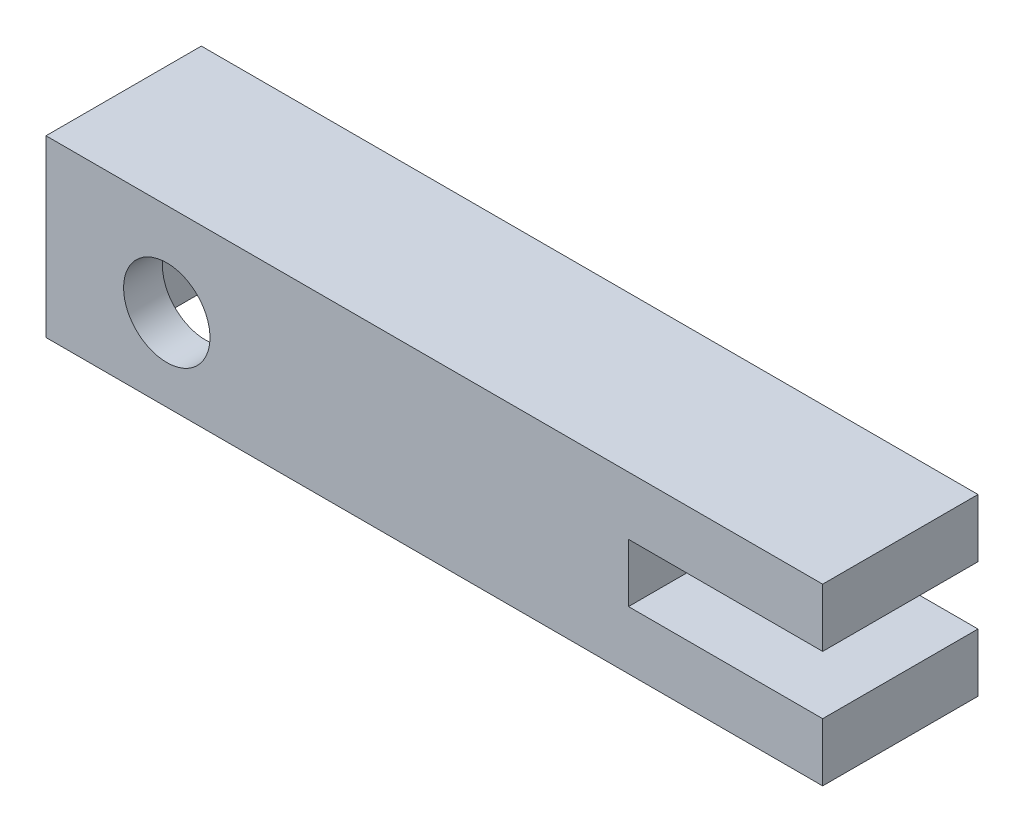
from build123d import *

# Parameters (mm, degrees)
CROQUIS1_W              = 350
CROQUIS1_H              = 40
SALIENTE_EXTRUIR1_DEPTH = 45
CROQUIS2_W              = 42.2
CROQUIS2_H              = 42.2
CORTAR_EXTRUIR1_DEPTH   = 30
CROQUIS3_R              = 11.125
CORTAR_EXTRUIR2_DEPTH   = 30
CROQUIS4_R              = 11.125
CORTAR_EXTRUIR3_DEPTH   = 186.067555233


with BuildPart() as part:
    # Croquis1 → Saliente-Extruir1 (new body)
    with BuildSketch(Plane(origin=(0, 0, 0), x_dir=(1, 0, 0), z_dir=(0, 1, 0))):
        Rectangle(CROQUIS1_W, CROQUIS1_H)
    extrude(amount=SALIENTE_EXTRUIR1_DEPTH)

    # Croquis2 → Cortar-Extruir1 (cut)
    with BuildSketch(Plane(origin=(0, 0, -20), x_dir=(-1, 0, 0), z_dir=(0, 0, -1))):
        with Locations((-143.9, 21.1)):
            Rectangle(CROQUIS2_W, CROQUIS2_H)
    cortar_extruir1 = extrude(amount=-CORTAR_EXTRUIR1_DEPTH, mode=Mode.SUBTRACT)

    # Croquis3 → Cortar-Extruir2 (cut)
    with BuildSketch(Plane(origin=(0, 0, 10), x_dir=(-1, 0, 0), z_dir=(0, 0, -1))):
        with Locations((-143.9, 21.1)):
            Circle(CROQUIS3_R)
    cortar_extruir2 = extrude(amount=-CORTAR_EXTRUIR2_DEPTH, mode=Mode.SUBTRACT)

    # Simetría1: Cortar-Extruir1, Cortar-Extruir2 across plane
    add(cortar_extruir1.mirror(Plane(origin=(0, 0, 0), x_dir=(0, 0, 1), z_dir=(1, 0, 0))), mode=Mode.SUBTRACT)
    add(cortar_extruir2.mirror(Plane(origin=(0, 0, 0), x_dir=(0, 0, 1), z_dir=(1, 0, 0))), mode=Mode.SUBTRACT)

    # Croquis4 → Cortar-Extruir3 (cut, through all)
    with BuildSketch(Plane.XY.offset(20)):
        Polygon((25, 15), (25, 0), (175, 0), (175, 45), (25, 45), (25, 30), (-25, 30), (-25, 15), align=None)
        with Locations((143.9, 21.1)):
            Circle(CROQUIS4_R, mode=Mode.SUBTRACT)
    extrude(amount=-CORTAR_EXTRUIR3_DEPTH, mode=Mode.SUBTRACT)


solid = part.part
